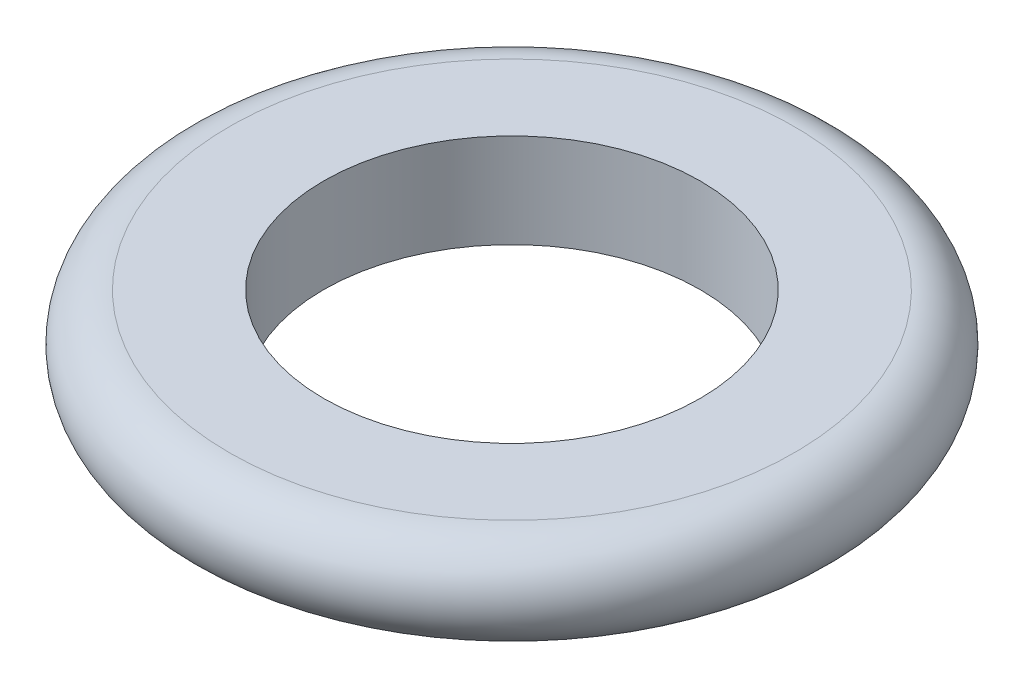
from build123d import *


with BuildPart() as part:
    # 草图1 → 旋转1 (revolve)
    with BuildSketch(Plane.XY, mode=Mode.PRIVATE) as revolve_1_sk:
        with BuildLine():
            Line((-6, 1), (-4, 1))
            Line((-4, 1), (-4, 3))
            Line((-4, 3), (-6, 3))
            ThreePointArc((-6, 3), (-7, 2), (-6, 1))
        make_face()
    revolve(revolve_1_sk.sketch.rotate(Axis((0, 3.511811024, 0), (0, -1, 0)), 270), axis=Axis((0, 3.511811024, 0), (0, -1, 0)))


solid = part.part
